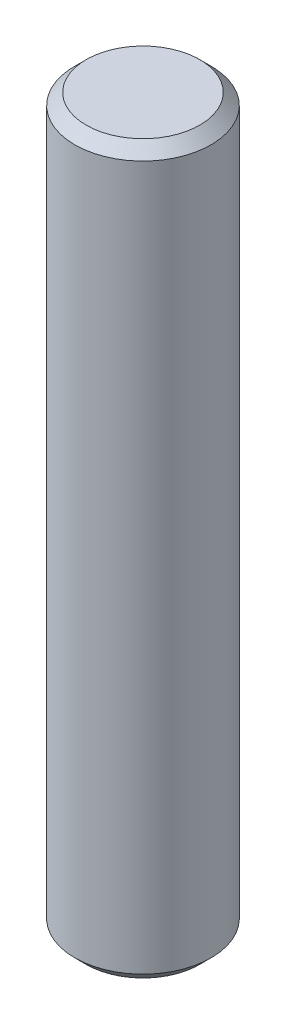
from build123d import *

# Parameters (mm, degrees)
SKETCH1_R           = 3
BOSS_EXTRUDE1_DEPTH = 32
CHAMFER1_SIZE       = 0.5


with BuildPart() as part:
    # Sketch1 → Boss-Extrude1 (new body)
    with BuildSketch(Plane(origin=(0, 0, 0), x_dir=(1, 0, 0), z_dir=(0, 1, 0))):
        with Locations(Location((0, 0, 0), (0, 0, 270))):
            Circle(SKETCH1_R)
    extrude(amount=-BOSS_EXTRUDE1_DEPTH)

    # Chamfer1
    chamfer1_edges = [part.edges().sort_by_distance(p)[0] for p in [
        (0, 0, -3),
        (0, -32, -3),
    ]]
    chamfer(chamfer1_edges, length=CHAMFER1_SIZE)


solid = part.part
